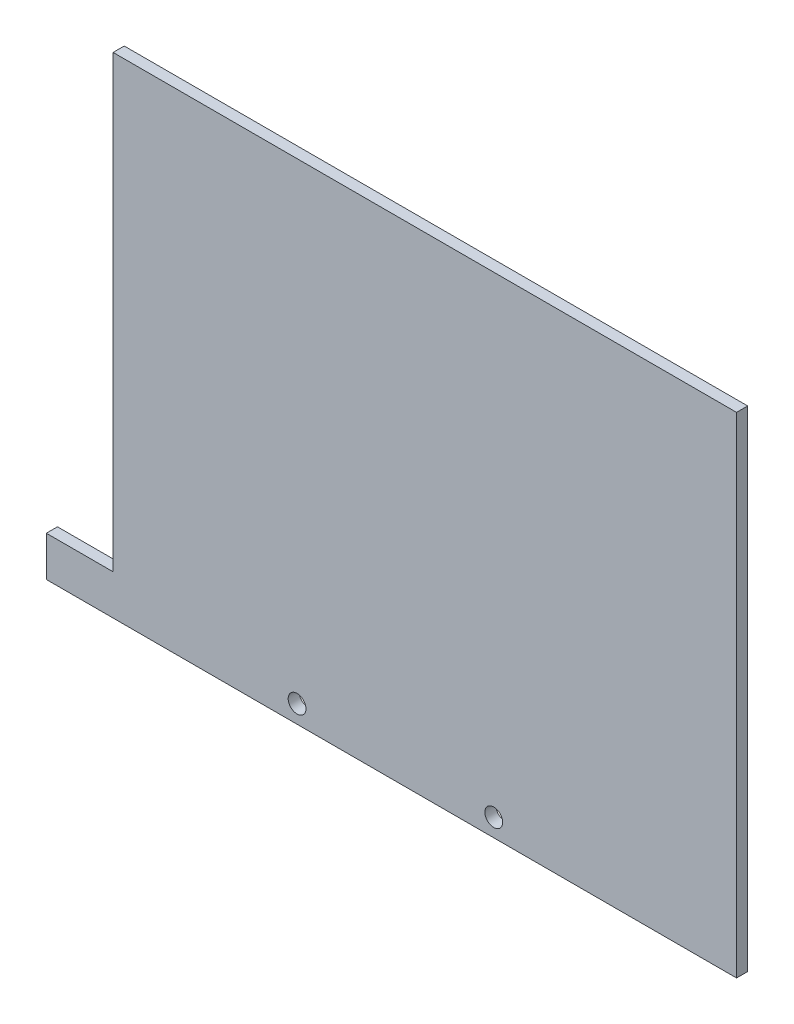
from build123d import *

# Parameters (mm, degrees)
SKETCH1_W           = 280
SKETCH1_H           = 220
SKETCH1_W_2         = 30
SKETCH1_H_2         = 18
BOSS_EXTRUDE1_DEPTH = 5
SKETCH2_R           = 4
CUT_EXTRUDE1_DEPTH  = 10


with BuildPart() as part:
    # Sketch1 → Boss-Extrude1 (new body)
    with BuildSketch(Plane.XY):
        Rectangle(SKETCH1_W, SKETCH1_H)
        with Locations((-155, -101)):
            Rectangle(SKETCH1_W_2, SKETCH1_H_2)
    extrude(amount=BOSS_EXTRUDE1_DEPTH)

    # Sketch2 → Cut-Extrude1 (cut)
    with BuildSketch(Plane.XY.offset(5)):
        with Locations((-57.377117084, -102)):
            Circle(SKETCH2_R)
        with Locations((30.950491695, -102)):
            Circle(SKETCH2_R)
    extrude(amount=-CUT_EXTRUDE1_DEPTH, mode=Mode.SUBTRACT)


solid = part.part
